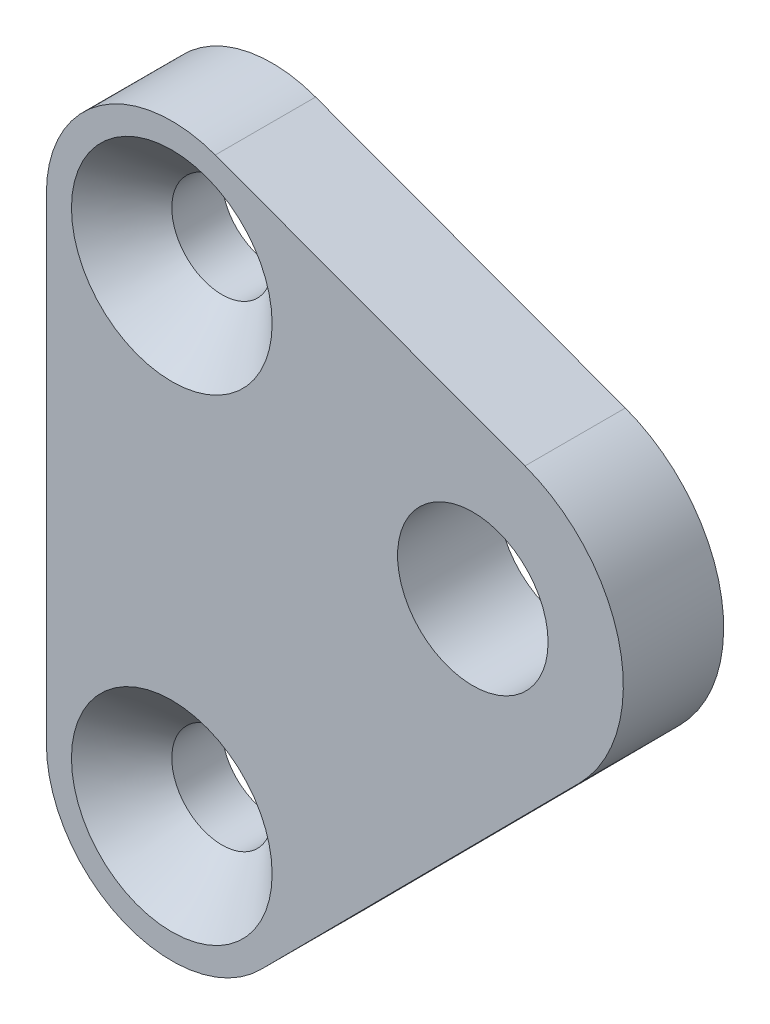
from build123d import *

# Parameters (mm, degrees)
SKETCH_1_R      = 2
SKETCH_1_R_2    = 3
EXTRUDE_1_DEPTH = 4
CHAMFER_1_SIZE  = 2


with BuildPart() as part:
    # 草图1 → 凸台-拉伸1 (new body)
    with BuildSketch(Plane.XY):
        with BuildLine():
            Line((13, 9.5), (13, -9.5))
            ThreePointArc((13, -9.5), (16.094355016, -14.122609349), (21.547406878, -13.023620928))
            Line((21.547406878, -13.023620928), (34.256888253, -0.228345114))
            ThreePointArc((34.256888253, -0.228345114), (35.858751307, 5.294230708), (32.07954512, 9.628098444))
            Line((32.07954512, 9.628098444), (19.732954267, 14.190082037))
            ThreePointArc((19.732954267, 14.190082037), (15.142096164, 13.602729051), (13, 9.5))
        make_face()
        with Locations((18, 9.5)):
            Circle(SKETCH_1_R, mode=Mode.SUBTRACT)
        with Locations((18, -9.5)):
            Circle(SKETCH_1_R, mode=Mode.SUBTRACT)
        with Locations((30, 4)):
            Circle(SKETCH_1_R_2, mode=Mode.SUBTRACT)
    extrude(amount=EXTRUDE_1_DEPTH)

    # 倒角1
    chamfer_1_edges = [part.edges().sort_by_distance(p)[0] for p in [
        (16, 9.5, 4),
        (16, -9.5, 4),
    ]]
    chamfer(chamfer_1_edges, length=CHAMFER_1_SIZE)


solid = part.part
